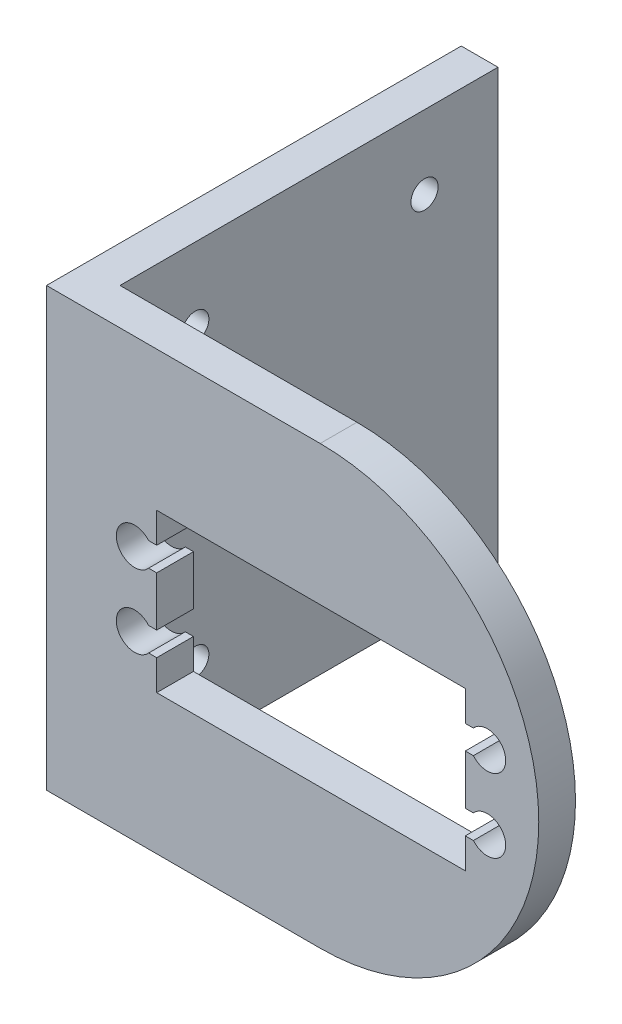
from build123d import *

# Parameters (mm, degrees)
BOSS_EXTRUDE1_DEPTH = 5
SKETCH3_W           = 56.45
SKETCH3_H           = 59.5
SKETCH3_R           = 1.85
BOSS_EXTRUDE3_DEPTH = 5
FILLET2_RADIUS      = 29.75
FILLET2_LENGTH      = 5


with BuildPart() as part:
    # Sketch1 → Boss-Extrude1 (new body)
    with BuildSketch(Plane.XY):
        Polygon((-31, 29.75), (-21, 29.75), (21, 29.75), (31, 29.75), (31, -29.75), (21, -29.75), (-21, -29.75), (-31, -29.75), align=None)
        with BuildLine():
            Line((-22.100164481, 6.625), (-21, 6.625))
            Line((-21, 6.625), (-21, 10.75))
            Line((-21, 10.75), (21.035787675, 10.75))
            Line((21.035787675, 10.75), (21, 6.625))
            Line((21, 6.625), (22.100164481, 6.625))
            ThreePointArc((22.100164481, 6.625), (26.5, 5), (22.100164481, 3.375))
            Line((22.100164481, 3.375), (21, 3.375))
            Line((21, 3.375), (21, -3.375))
            Line((21, -3.375), (22.100164481, -3.375))
            ThreePointArc((22.100164481, -3.375), (26.5, -5), (22.100164481, -6.625))
            Line((22.100164481, -6.625), (21, -6.625))
            Line((21, -6.625), (21, -10.75))
            Line((21, -10.75), (-21, -10.75))
            Line((-21, -10.75), (-21, -6.625))
            Line((-21, -6.625), (-22.100164481, -6.625))
            ThreePointArc((-22.100164481, -6.625), (-26.5, -5), (-22.100164481, -3.375))
            Line((-22.100164481, -3.375), (-21, -3.375))
            Line((-21, -3.375), (-21, 3.375))
            Line((-21, 3.375), (-22.100164481, 3.375))
            ThreePointArc((-22.100164481, 3.375), (-26.5, 5), (-22.100164481, 6.625))
        make_face(mode=Mode.SUBTRACT)
    extrude(amount=BOSS_EXTRUDE1_DEPTH)

    # Sketch3 → Boss-Extrude3 (add)
    with BuildSketch(Plane.ZY.offset(31)):
        with Locations((-23.225, 0)):
            Rectangle(SKETCH3_W, SKETCH3_H)
        with Locations(Location((-41.45, 19.75, 0), (0, 0, 270))):
            Circle(SKETCH3_R, mode=Mode.SUBTRACT)
        with Locations(Location((-41.45, -19.75, 0), (0, 0, 90))):
            Circle(SKETCH3_R, mode=Mode.SUBTRACT)
        with Locations(Location((-10.25, -19.75, 0), (0, 0, 270))):
            Circle(SKETCH3_R, mode=Mode.SUBTRACT)
        with Locations(Location((-10.25, 19.75, 0), (0, 0, 90))):
            Circle(SKETCH3_R, mode=Mode.SUBTRACT)
    extrude(amount=BOSS_EXTRUDE3_DEPTH)

    # Fillet2: full round fillet: the end face becomes a half cylinder, R = half its width
    fillet2_face = Plane((31, 0, 2.5), x_dir=(0, 0, 1), z_dir=(1, 0, 0))  # on the end face: x along it, z out of the body
    fillet2_slab = fillet2_face.offset(-FILLET2_RADIUS / 2) * Box(FILLET2_LENGTH, 2 * FILLET2_RADIUS, FILLET2_RADIUS, mode=Mode.PRIVATE)  # the body's end, R deep
    fillet2_round = Plane((1.25, 0, 2.5), x_dir=(1, 0, 0), z_dir=(0, 0, 1)) * Cylinder(FILLET2_RADIUS, FILLET2_LENGTH, mode=Mode.PRIVATE)  # its axis R under the face
    add(fillet2_slab - fillet2_round, mode=Mode.SUBTRACT)


solid = part.part
